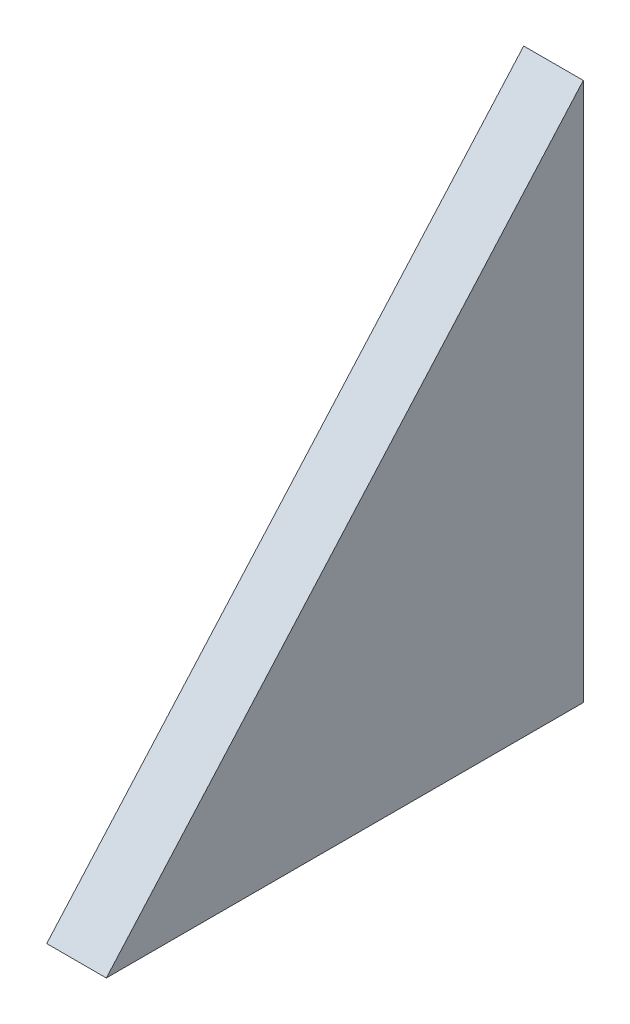
from build123d import *

# Parameters (mm, degrees)
SALIENTE_EXTRUIR1_DEPTH = 8


with BuildPart() as part:
    # Croquis1 → Saliente-Extruir1 (new body)
    with BuildSketch(Plane(origin=(0, 0, 0), x_dir=(0, 0, -1), z_dir=(1, 0, 0))):
        Polygon((-32.07437781, -36.234023682), (31.92562219, -36.234023682), (31.92562219, 36.065976318), align=None)
    extrude(amount=SALIENTE_EXTRUIR1_DEPTH)


solid = part.part
